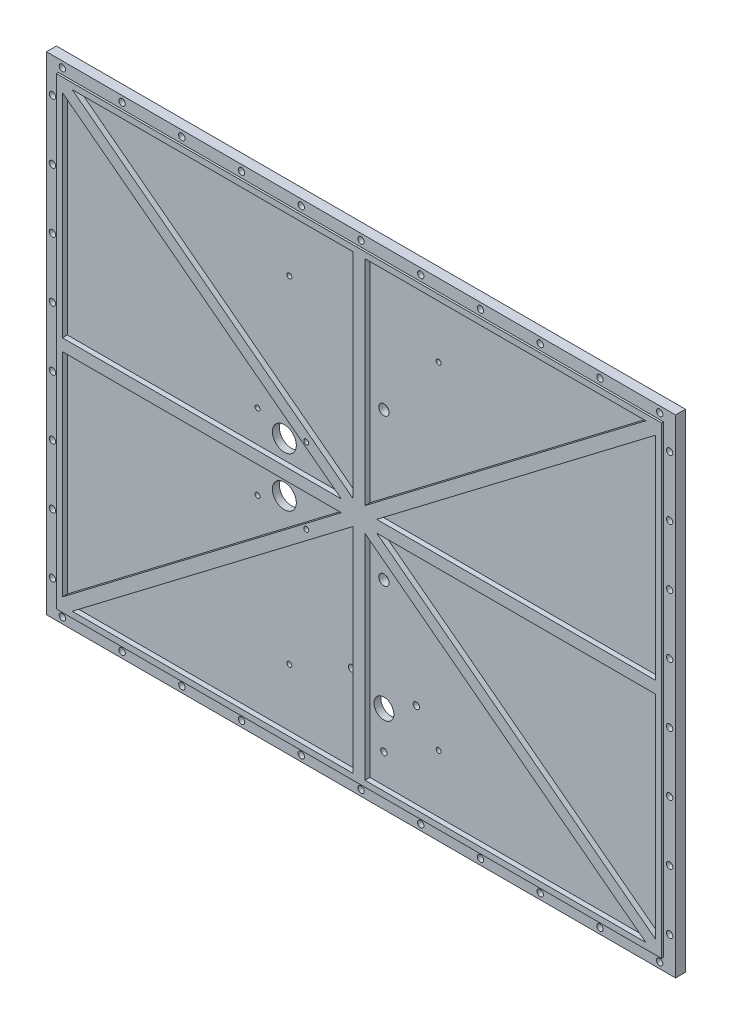
from build123d import *

# Parameters (mm, degrees)
SKETCH_1_W             = 316
SKETCH_1_H             = 244.9
EXTRUDE_1_DEPTH        = 6
CUT_EXTRUDE_START      = 6
SKETCH_1_3_W           = 316
SKETCH_1_3_H           = 244.9
SKETCH_1_3_W_2         = 304
SKETCH_1_3_H_2         = 232.9
CUT_EXTRUDE_1_DEPTH    = 1
HOLE_WIZARD_M3_1_D     = 3.2
HOLE_WIZARD_M3_2_D     = 3.2
PATTERN_LINEAR_1_COUNT = 11
PATTERN_LINEAR_1_PITCH = 30
PATTERN_LINEAR_2_COUNT = 8
PATTERN_LINEAR_2_PITCH = 30
CUT_EXTRUDE_2_DEPTH    = 2.5
SKETCH_6_R             = 2.6
SKETCH_6_R_2           = 1.6
SKETCH_6_R_3           = 5
CUT_EXTRUDE_3_DEPTH    = 200.985005688
M3X0_5_1_D             = 2.5
SKETCH_7_R             = 6
CUT_EXTRUDE_5_DEPTH    = 200.985005688


with BuildPart() as part:
    # ｽｹｯﾁ1 → ﾎﾞｽ - 押し出し1 (new body)
    with BuildSketch(Plane.XY):
        Rectangle(SKETCH_1_W, SKETCH_1_H)
    extrude(amount=EXTRUDE_1_DEPTH)

    # ｽｹｯﾁ1<3> → ｶｯﾄ - 押し出し1 (cut)
    with BuildSketch(Plane.XY.offset(CUT_EXTRUDE_START)):
        Rectangle(SKETCH_1_3_W, SKETCH_1_3_H)
        Rectangle(SKETCH_1_3_W_2, SKETCH_1_3_H_2, mode=Mode.SUBTRACT)
    extrude(amount=-CUT_EXTRUDE_1_DEPTH, mode=Mode.SUBTRACT)

    # M3 すきま穴1 (through all)
    with Locations(Plane(origin=(155, 105, 0), x_dir=(-1, 0, 0), z_dir=(0, 0, -1))):
        with Locations((0, 0), (310, 0)):
            hole_wizard_m3_1 = Hole(HOLE_WIZARD_M3_1_D / 2)

    # M3 すきま穴2 (through all)
    with Locations(Plane(origin=(-150, 119.45, 0), x_dir=(-1, 0, 0), z_dir=(0, 0, -1))):
        with Locations((0, 0), (0, -238.9)):
            hole_wizard_m3_2 = Hole(HOLE_WIZARD_M3_2_D / 2)

    # 直線ﾊﾟﾀｰﾝ1: M3 すきま穴2 ×11
    with Locations(*[(i * PATTERN_LINEAR_1_PITCH, 0, 0) for i in range(1, PATTERN_LINEAR_1_COUNT)]):
        add(hole_wizard_m3_2, mode=Mode.SUBTRACT)

    # 直線ﾊﾟﾀｰﾝ2: M3 すきま穴1 ×8
    with Locations(*[(0, -i * PATTERN_LINEAR_2_PITCH, 0) for i in range(1, PATTERN_LINEAR_2_COUNT)]):
        add(hole_wizard_m3_1, mode=Mode.SUBTRACT)

    # ｽｹｯﾁ5 → ｶｯﾄ - 押し出し2 (cut)
    with BuildSketch(Plane.XY.offset(6)):
        Polygon((-3, -6.054864529), (-3, -113.45), (-144.047820055, -113.45), align=None)
        Polygon((-149, 109.679363659), (-8.892241646, 3), (-149, 3), align=None)
        Polygon((144.047820055, 113.45), (3, 113.45), (3, 6.054864529), align=None)
        Polygon((149, -109.679363659), (149, -3), (8.892241646, -3), align=None)
        Polygon((-144.047820055, 113.45), (-3, 6.054864529), (-3, 113.45), align=None)
        Polygon((3, -6.054864529), (144.047820055, -113.45), (3, -113.45), align=None)
        Polygon((-149, -109.679363659), (-8.892241646, -3), (-149, -3), align=None)
        Polygon((149, 3), (149, 109.679363659), (8.892241646, 3), align=None)
    extrude(amount=-CUT_EXTRUDE_2_DEPTH, mode=Mode.SUBTRACT)

    # ｽｹｯﾁ6 → ｶｯﾄ - 押し出し3 (cut, through all)
    with BuildSketch(Plane.XY.offset(6)):
        with Locations((10, -24)):
            Circle(SKETCH_6_R)
        with Locations((10, 50)):
            Circle(SKETCH_6_R)
        with Locations((10, -98.8)):
            Circle(SKETCH_6_R_2)
        with Locations((-6.281277591, -70.6)):
            Circle(SKETCH_6_R_2)
        with Locations((26.281277591, -70.6)):
            Circle(SKETCH_6_R_2)
        with Locations((10, -80)):
            Circle(SKETCH_6_R_3)
    extrude(amount=-CUT_EXTRUDE_3_DEPTH, mode=Mode.SUBTRACT)

    # M3x0.5 ねじ穴1 (through all)
    with Locations(Plane(origin=(0, 0, 0), x_dir=(-1, 0, 0), z_dir=(0, 0, -1))):
        with Locations((-37.5, 84.45), (37.5, 84.45), (53.5, -19), (53.5, 19), (26.5, 19), (26.5, -19), (37.5, -84.45), (-37.5, -84.45)):
            Hole(M3X0_5_1_D / 2)

    # ｽｹｯﾁ7 → ｶｯﾄ - 押し出し5 (cut, through all)
    with BuildSketch(Plane(origin=(0, 0, 0), x_dir=(-1, 0, 0), z_dir=(0, 0, -1))):
        with Locations((40, 12.5)):
            Circle(SKETCH_7_R)
        with Locations(Location((40, -12.5, 0), (0, 0, 180))):
            Circle(SKETCH_7_R)
    extrude(amount=-CUT_EXTRUDE_5_DEPTH, mode=Mode.SUBTRACT)


solid = part.part
